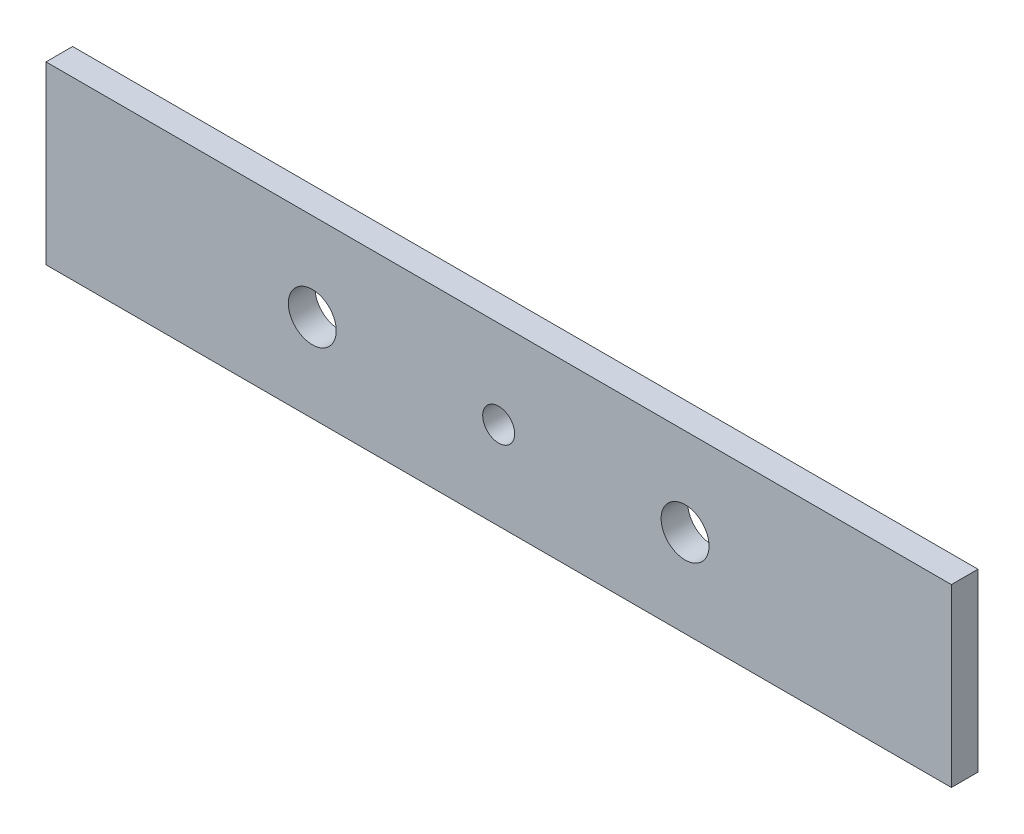
from build123d import *

# Parameters (mm, degrees)
SKETCH1_W           = 170
SKETCH1_H           = 5
BOSS_EXTRUDE1_DEPTH = 33
SKETCH2_R           = 3
SKETCH2_R_2         = 4.5
CUT_EXTRUDE1_DEPTH  = 29


with BuildPart() as part:
    # Sketch1 → Boss-Extrude1 (new body)
    with BuildSketch(Plane(origin=(0, 0, 0), x_dir=(1, 0, 0), z_dir=(0, 1, 0))):
        with Locations((85, 2.5)):
            Rectangle(SKETCH1_W, SKETCH1_H)
    extrude(amount=BOSS_EXTRUDE1_DEPTH)

    # Sketch2 → Cut-Extrude1 (cut)
    with BuildSketch(Plane.XY):
        with Locations((85, 16.5)):
            Circle(SKETCH2_R)
        with Locations((120, 16.5)):
            Circle(SKETCH2_R_2)
        with Locations((50, 16.5)):
            Circle(SKETCH2_R_2)
    extrude(amount=-CUT_EXTRUDE1_DEPTH, mode=Mode.SUBTRACT)


solid = part.part
